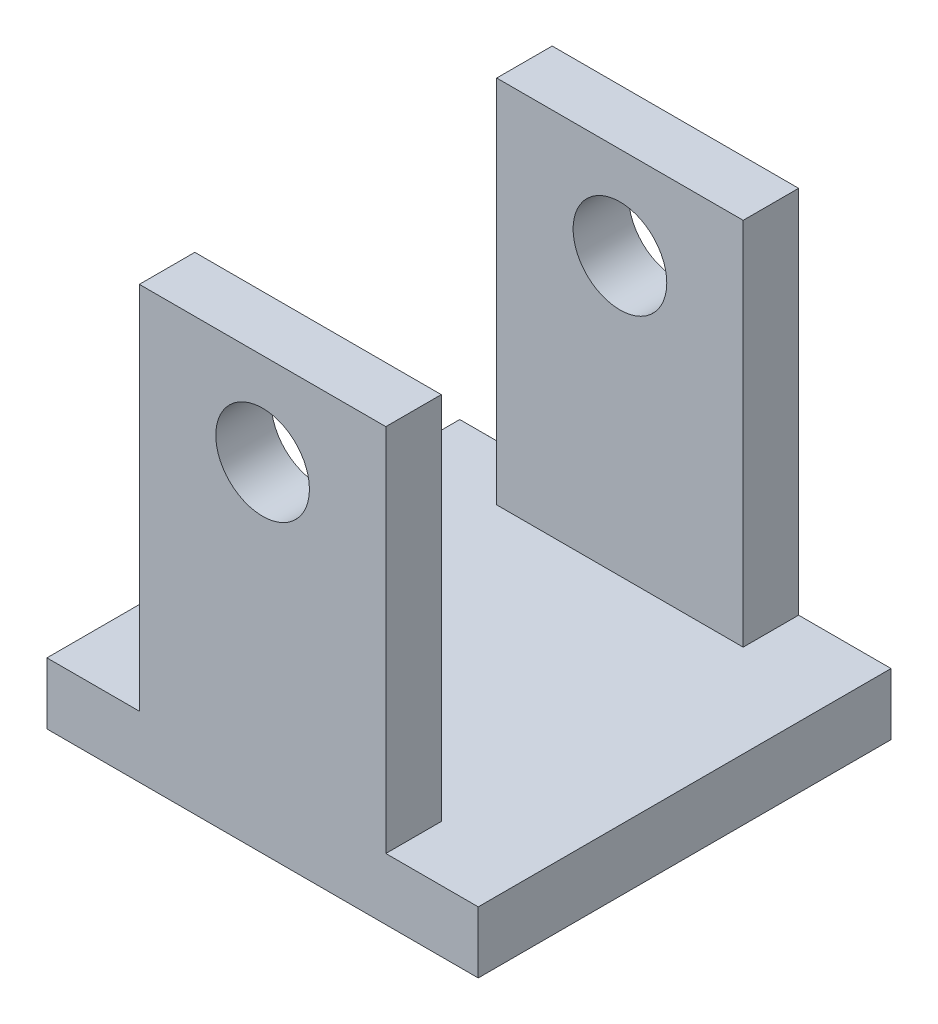
from build123d import *

# Parameters (mm, degrees)
SKETCH2_W               = 70
SKETCH2_H               = 10
BOSS_EXTRUDE1_DEPTH     = 33.5
SKETCH3_W               = 40
SKETCH3_H               = 60
BOSS_EXTRUDE2_DEPTH     = 33.5
SKETCH4_W               = 40
SKETCH4_H               = 60
CUT_EXTRUDE1_DEPTH      = 24.5
CUT_EXTRUDE2_DEPTH      = 74.295634249
CUT_EXTRUDE2_DEPTH_BACK = 74.295634249
SKETCH5_R               = 7.6


with BuildPart() as part:
    # Sketch2 → Boss-Extrude1 (new, symmetric)
    with BuildSketch(Plane.XY):
        with Locations((0, -50)):
            Rectangle(SKETCH2_W, SKETCH2_H)
    extrude(amount=BOSS_EXTRUDE1_DEPTH, both=True)

    # Sketch3 → Boss-Extrude2 (add, symmetric)
    with BuildSketch(Plane.XY):
        with Locations((0, -15)):
            Rectangle(SKETCH3_W, SKETCH3_H)
    extrude(amount=BOSS_EXTRUDE2_DEPTH, both=True)

    # Sketch4 → Cut-Extrude1 (cut, symmetric)
    with BuildSketch(Plane.XY):
        with Locations((0, -15)):
            Rectangle(SKETCH4_W, SKETCH4_H)
    extrude(amount=CUT_EXTRUDE1_DEPTH, both=True, mode=Mode.SUBTRACT)

    # Sketch5 → Cut-Extrude2 (cut, two sides: drawn at the far end of the back side and taken through both)
    with BuildSketch(Plane.XY.offset(-CUT_EXTRUDE2_DEPTH_BACK)):
        Circle(SKETCH5_R)
    extrude(amount=CUT_EXTRUDE2_DEPTH + CUT_EXTRUDE2_DEPTH_BACK, mode=Mode.SUBTRACT)


solid = part.part
